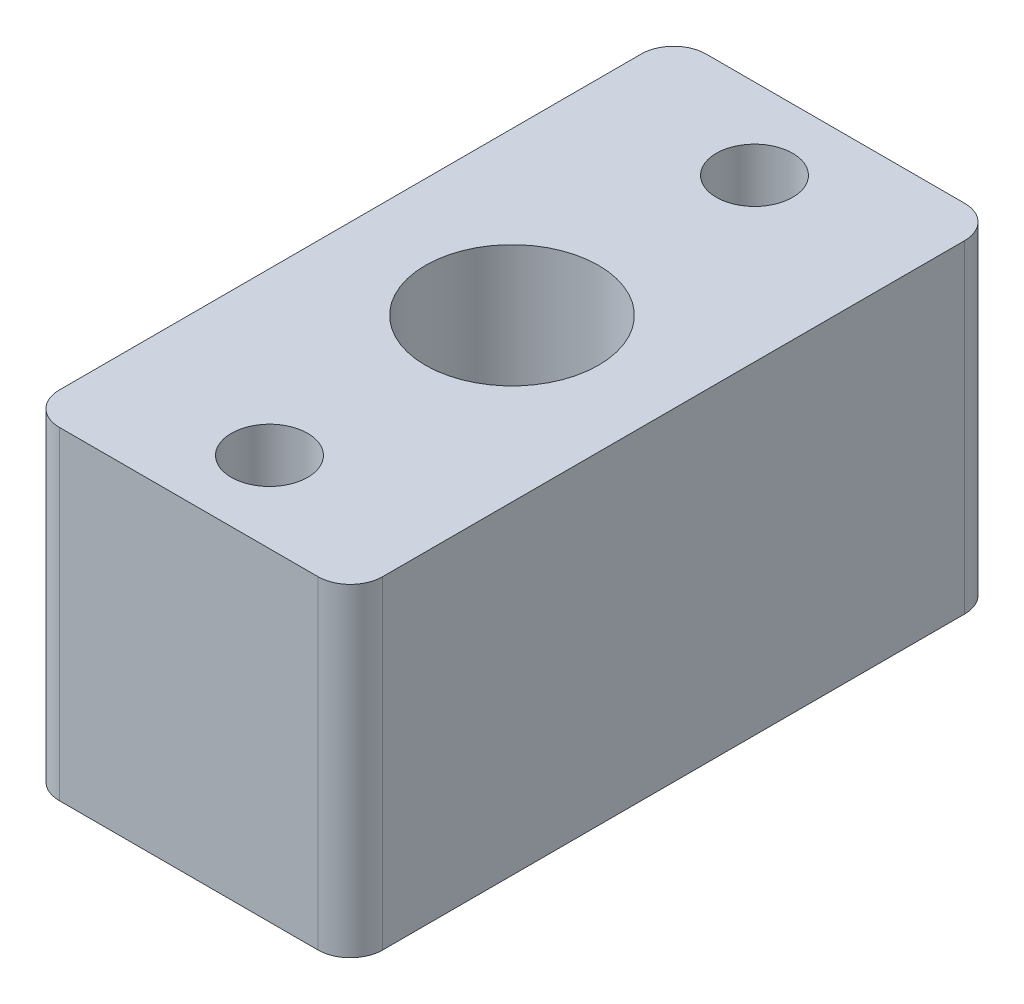
from build123d import *

# Parameters (mm, degrees)
SKETCH2_W                = 12.7
SKETCH2_H                = 25.4
BOSS_EXTRUDE1_DEPTH      = 12.7
FILLET1_R                = 1.27
M8_TAPPED_HOLE1_D        = 6.8
M8_TAPPED_HOLE1_DEPTH    = 22.352
M8_TAPPED_HOLE1_TIP      = 2.042926105
F_3_0_3_DIAMETER_HOLE1_D = 3


with BuildPart() as part:
    # Sketch2 → Boss-Extrude1 (new body)
    with BuildSketch(Plane(origin=(0.747955349, -17998.493433647, -0.21189001), x_dir=(0.9999999990426253, 4.1556714470297764e-05, -1.3703612374546656e-05), z_dir=(4.155655314345303e-05, -0.9999999990672288, -1.1772652539431076e-05))):
        with Locations((2.867307998, -495.77508586)):
            Rectangle(SKETCH2_W, SKETCH2_H)
    extrude(amount=BOSS_EXTRUDE1_DEPTH)

    # Fillet1
    fillet1_edges = [part.edges().sort_by_distance(p)[0] for p in [
        (9.958907112, -18004.8373638, -483.287176858),
        (-2.741092876, -18004.83789157, -483.287002822),
        (-2.74144096, -18004.837592559, -508.687002818),
        (9.958559027, -18004.837064789, -508.687176854),
    ]]
    fillet(fillet1_edges, radius=FILLET1_R)

    # M8 Tapped Hole1
    with Locations(Plane(origin=(0.747955347, -17998.493433647, -0.21189001), x_dir=(0.9999999991365266, 4.155655299545149e-05, 4.892308607553357e-10), z_dir=(-4.155655299833127e-05, 0.9999999990672289, 1.177265256703421e-05))):
        with Locations((2.860513847, 495.775125107)):
            Hole(M8_TAPPED_HOLE1_D / 2, depth=M8_TAPPED_HOLE1_DEPTH)
            with Locations((0, 0, -(M8_TAPPED_HOLE1_DEPTH + M8_TAPPED_HOLE1_TIP / 2))):  # 118° drill point
                Cone(0, M8_TAPPED_HOLE1_D / 2, M8_TAPPED_HOLE1_TIP, mode=Mode.SUBTRACT)

    # Ø3.0 (3) Diameter Hole1 (through all)
    with Locations(Plane(origin=(0.747955347, -17998.493433647, -0.21189001), x_dir=(0.9999999991365266, 4.155655299545149e-05, 4.892308607553357e-10), z_dir=(-4.155655299833127e-05, 0.9999999990672289, 1.177265256703421e-05))):
        with Locations((2.860644379, 486.250125108), (2.860383315, 505.300125107)):
            Hole(F_3_0_3_DIAMETER_HOLE1_D / 2)


solid = part.part
